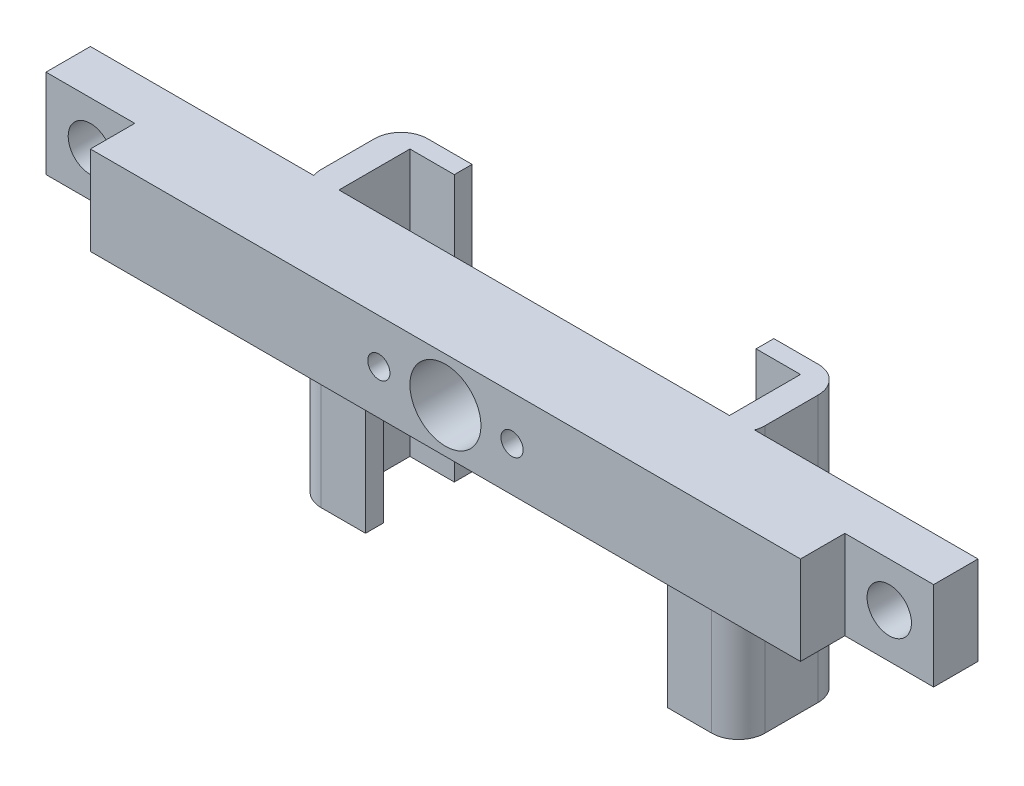
from build123d import *

# Parameters (mm, degrees)
SKETCH1_W           = 100
SKETCH1_H           = 10
BOSS_EXTRUDE1_DEPTH = 10
SKETCH6_W           = 3
SKETCH6_H           = 10
BOSS_EXTRUDE2_DEPTH = 10
SKETCH8_W           = 2
SKETCH8_H           = 10
BOSS_EXTRUDE3_DEPTH = 5
BOSS_EXTRUDE4_DEPTH = 20
SKETCH2_W           = 10
SKETCH2_H           = 5
CUT_EXTRUDE1_DEPTH  = 10
CUT_EXTRUDE2_REACH  = 59.879
SKETCH10_R          = 2.5
CUT_EXTRUDE3_REACH  = 58.789
SKETCH13_R          = 4
SKETCH13_R_2        = 1.25
FILLET1_R           = 3
FILLET2_R           = 3


with BuildPart() as part:
    # Sketch1 → Boss-Extrude1 (new body)
    with BuildSketch(Plane.XY):
        Rectangle(SKETCH1_W, SKETCH1_H)
    extrude(amount=BOSS_EXTRUDE1_DEPTH)

    # Sketch6 → Boss-Extrude2 (add)
    with BuildSketch(Plane(origin=(0, 0, 0), x_dir=(-1, 0, 0), z_dir=(0, 0, -1))):
        with Locations((-23.5, 0)):
            Rectangle(SKETCH6_W, SKETCH6_H)
    boss_extrude2 = extrude(amount=BOSS_EXTRUDE2_DEPTH)

    # Sketch8 → Boss-Extrude3 (add)
    with BuildSketch(Plane.ZY.offset(-22)):
        with Locations((-9, 0)):
            Rectangle(SKETCH8_W, SKETCH8_H)
    boss_extrude3 = extrude(amount=BOSS_EXTRUDE3_DEPTH)

    # Sketch9 → Boss-Extrude4 (add)
    with BuildSketch(Plane.XZ.offset(5)):
        Polygon((17, 2), (17, 0), (22, 0), (22, -8), (17, -8), (17, -10), (25, -10), (25, 0), (25, 2), align=None)
    boss_extrude4 = extrude(amount=BOSS_EXTRUDE4_DEPTH)

    # Mirror3: Boss-Extrude2, Boss-Extrude3, Boss-Extrude4 across plane
    add(boss_extrude2.mirror(Plane(origin=(0, 0, 0), x_dir=(0, 0, 1), z_dir=(1, 0, 0))))
    add(boss_extrude3.mirror(Plane(origin=(0, 0, 0), x_dir=(0, 0, 1), z_dir=(1, 0, 0))))
    add(boss_extrude4.mirror(Plane(origin=(0, 0, 0), x_dir=(0, 0, 1), z_dir=(1, 0, 0))))

    # Sketch2 → Cut-Extrude1 (cut)
    with BuildSketch(Plane(origin=(0, 5, 0), x_dir=(1, 0, 0), z_dir=(0, 1, 0))):
        with Locations((-45, -7.5)):
            Rectangle(SKETCH2_W, SKETCH2_H)
    cut_extrude1 = extrude(amount=-CUT_EXTRUDE1_DEPTH, mode=Mode.SUBTRACT)

    # Mirror4: Cut-Extrude1 across plane
    add(cut_extrude1.mirror(Plane(origin=(0, 0, 0), x_dir=(0, 0, 1), z_dir=(1, 0, 0))), mode=Mode.SUBTRACT)

    # Sketch10 → Cut-Extrude2 (cut, up to next)
    with BuildSketch(Plane.XY.offset(5), mode=Mode.PRIVATE) as cut_extrude2_sk1:
        with Locations((45, 0)):
            Circle(SKETCH10_R)
    cut_extrude2_tool1 = extrude(cut_extrude2_sk1.sketch, amount=-CUT_EXTRUDE2_REACH, mode=Mode.PRIVATE) & part.part
    cut_extrude2 = cut_extrude2_tool1.solids().sort_by_distance((45, 0, 5))[0]
    add(cut_extrude2, mode=Mode.SUBTRACT)

    # Mirror5: Cut-Extrude2 across plane
    add(cut_extrude2.mirror(Plane(origin=(0, 0, 0), x_dir=(0, 0, 1), z_dir=(1, 0, 0))), mode=Mode.SUBTRACT)

    # Sketch13 → Cut-Extrude3 (cut, up to next)
    with BuildSketch(Plane(origin=(0, 0, 0), x_dir=(-1, 0, 0), z_dir=(0, 0, -1)), mode=Mode.PRIVATE) as cut_extrude3_sk1:
        Circle(SKETCH13_R)
    cut_extrude3_tool1 = extrude(cut_extrude3_sk1.sketch, amount=-CUT_EXTRUDE3_REACH, mode=Mode.PRIVATE) & part.part
    # Sketch13 → Cut-Extrude3 (cut, up to next)
    with BuildSketch(Plane(origin=(0, 0, 0), x_dir=(-1, 0, 0), z_dir=(0, 0, -1)), mode=Mode.PRIVATE) as cut_extrude3_sk2:
        with Locations((-7.5, 0)):
            Circle(SKETCH13_R_2)
    cut_extrude3_tool2 = extrude(cut_extrude3_sk2.sketch, amount=-CUT_EXTRUDE3_REACH, mode=Mode.PRIVATE) & part.part
    # Sketch13 → Cut-Extrude3 (cut, up to next)
    with BuildSketch(Plane(origin=(0, 0, 0), x_dir=(-1, 0, 0), z_dir=(0, 0, -1)), mode=Mode.PRIVATE) as cut_extrude3_sk3:
        with Locations((7.5, 0)):
            Circle(SKETCH13_R_2)
    cut_extrude3_tool3 = extrude(cut_extrude3_sk3.sketch, amount=-CUT_EXTRUDE3_REACH, mode=Mode.PRIVATE) & part.part
    add(cut_extrude3_tool1.solids().sort_by_distance((0, 0, 0))[0], mode=Mode.SUBTRACT)
    add(cut_extrude3_tool2.solids().sort_by_distance((7.5, 0, 0))[0], mode=Mode.SUBTRACT)
    add(cut_extrude3_tool3.solids().sort_by_distance((-7.5, 0, 0))[0], mode=Mode.SUBTRACT)

    # Fillet1
    fillet1_edges = [part.edges().sort_by_distance(p)[0] for p in [
        (25, -10, -10),
        (-25, -10, -10),
    ]]
    fillet(fillet1_edges, radius=FILLET1_R)

    # Fillet2
    fillet2_edges = [part.edges().sort_by_distance(p)[0] for p in [
        (-25, -15, 2),
        (25, -15, 2),
    ]]
    fillet(fillet2_edges, radius=FILLET2_R)


solid = part.part
